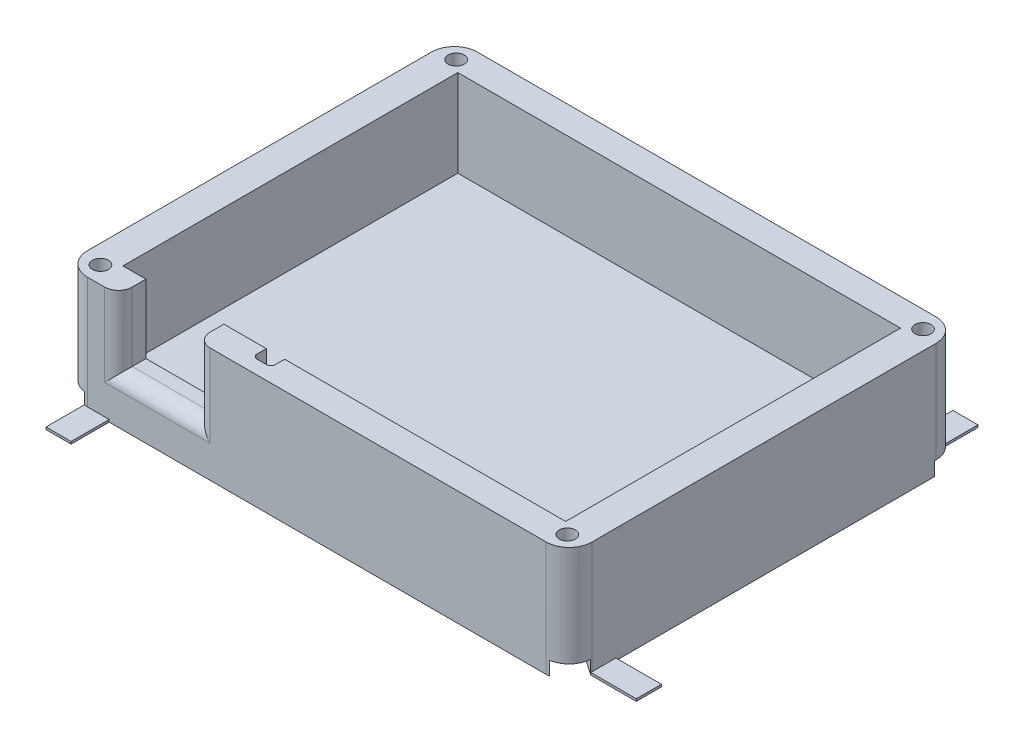
from build123d import *

# Parameters (mm, degrees)
SKETCH1_W                 = 110
SKETCH1_H                 = 85
BASE_DEPTH                = 25
FILLET1_R                 = 5
SKETCH2_W                 = 96.5
SKETCH2_H                 = 73
BASKET_DEPTH              = 19
SKETCH3_W                 = 4
SKETCH3_H                 = 6
WIRE_CHANNEL_DEPTH        = 19
WIRE_CHANNEL_ROUNDING_R   = 1
SWITCH_CUT_OUT_REACH      = 106.283
SKETCH5_W                 = 17
SKETCH5_H                 = 15
SWITCH_CUT_OUT_ROUNDING_R = 3
SKETCH14_R                = 1.75
CORNER_HOLES_DEPTH        = 74.866433513
BOTTOM_NUT_CUT_OUT_DEPTH  = 3
SKETCH18_W                = 8.304257035
SKETCH18_H                = 5.473277891
PRINTING_TIE_DOWNS_DEPTH  = 0.5


with BuildPart() as part:
    # Sketch1 → Base (new body)
    with BuildSketch(Plane(origin=(0, 0, 0), x_dir=(1, 0, 0), z_dir=(0, 1, 0))):
        Rectangle(SKETCH1_W, SKETCH1_H)
    extrude(amount=BASE_DEPTH)

    # Fillet1
    fillet1_edges = [part.edges().sort_by_distance(p)[0] for p in [
        (55, 12.5, 42.5),
        (-55, 12.5, 42.5),
        (-55, 12.5, -42.5),
        (55, 12.5, -42.5),
    ]]
    fillet(fillet1_edges, radius=FILLET1_R)

    # Sketch2 → Basket (cut)
    with BuildSketch(Plane(origin=(0, 25, 0), x_dir=(1, 0, 0), z_dir=(0, 1, 0))):
        Rectangle(SKETCH2_W, SKETCH2_H)
    extrude(amount=-BASKET_DEPTH, mode=Mode.SUBTRACT)

    # Sketch3 → Wire Channel (cut)
    with BuildSketch(Plane(origin=(0, 25, 0), x_dir=(1, 0, 0), z_dir=(0, 1, 0))):
        with Locations((-15, -36.5)):
            Rectangle(SKETCH3_W, SKETCH3_H)
    extrude(amount=-WIRE_CHANNEL_DEPTH, mode=Mode.SUBTRACT)

    # Wire Channel Rounding
    wire_channel_rounding_edges = [part.edges().sort_by_distance(p)[0] for p in [
        (-17, 15.5, 39.5),
        (-13, 15.5, 39.5),
    ]]
    fillet(wire_channel_rounding_edges, radius=WIRE_CHANNEL_ROUNDING_R)

    # Sketch5 → Switch Cut-out (cut, up to next)
    with BuildSketch(Plane.XY.offset(42.5), mode=Mode.PRIVATE) as switch_cut_out_sk1:
        with Locations((-34.75, 17.5)):
            Rectangle(SKETCH5_W, SKETCH5_H)
    switch_cut_out_tool1 = extrude(switch_cut_out_sk1.sketch, amount=-SWITCH_CUT_OUT_REACH, mode=Mode.PRIVATE) & part.part
    add(switch_cut_out_tool1.solids().sort_by_distance((-34.75, 17.5, 42.5))[0], mode=Mode.SUBTRACT)

    # Switch Cut-out Rounding
    switch_cut_out_rounding_edges = [part.edges().sort_by_distance(p)[0] for p in [
        (-43.25, 17.5, 42.5),
        (-34.75, 10, 42.5),
        (-26.25, 17.5, 42.5),
    ]]
    fillet(switch_cut_out_rounding_edges, radius=SWITCH_CUT_OUT_ROUNDING_R)

    # Sketch14 → Corner Holes (cut, through all)
    with BuildSketch(Plane(origin=(0, 25, 0), x_dir=(1, 0, 0), z_dir=(0, 1, 0))):
        with Locations(Location((-50.892766953, 38.767766953, 0), (0, 0, 270))):
            Circle(SKETCH14_R)
        with Locations(Location((50.892766953, 38.767766953, 0), (0, 0, 270))):
            Circle(SKETCH14_R)
        with Locations(Location((50.892766953, -38.767766953, 0), (0, 0, 270))):
            Circle(SKETCH14_R)
        with Locations(Location((-50.892766953, -38.767766953, 0), (0, 0, 270))):
            Circle(SKETCH14_R)
    extrude(amount=-CORNER_HOLES_DEPTH, mode=Mode.SUBTRACT)

    # Sketch15 → Bottom Nut Cut-out (cut)
    with BuildSketch(Plane.XZ):
        Polygon((-50.64101323, 42.388469214), (-52.178282629, 43.416097239), (-55.727023172, 38.10739593), (-54.143831126, 37.15203238), (-51.13140477, 35.13829702), (-47.868872697, 36.746365575), (-47.630234881, 40.375835508), align=None)
        Polygon((50.595962101, 42.39294376), (52.091508492, 43.427758232), (55.676210978, 38.247033564), (54.180664587, 37.212219092), (51.189571805, 35.142590146), (47.901674171, 36.698138008), (47.604869319, 40.323314814), align=None)
        Polygon((54.167766953, -36.699113605), (55.742766953, -37.608440279), (52.313760602, -43.547653498), (50.738760602, -42.638326824), (47.463760602, -40.747504693), (47.463760602, -36.788029213), (50.892766953, -34.808291473), align=None)
        Polygon((-53.9527362, -36.801402743), (-55.569189191, -37.634817242), (-52.682156679, -43.23437466), (-51.065703688, -42.400960161), (-47.832797706, -40.734131163), (-47.65986097, -37.100937955), (-50.719830218, -35.134573745), align=None)
    extrude(amount=-BOTTOM_NUT_CUT_OUT_DEPTH, mode=Mode.SUBTRACT)

    # Sketch18 → Printing Tie-downs (add)
    with BuildSketch(Plane.XZ):
        Polygon((-50.728122477, 42.446699673), (-50.728122477, 50.804257035), (-45.254844585, 50.804257035), (-45.254844585, 42.5), align=None)
        Polygon((54.992489727, 37.773945836), (64.927443113, 37.773945836), (64.927443113, 32.300667944), (55, 32.300667944), align=None)
        Polygon((50.462105691, -42.478600037), (50.462105691, -51.181840402), (44.9888278, -51.181840402), (44.9888278, -42.5), align=None)
        with Locations((-59.152128518, -34.604714443)):
            Rectangle(SKETCH18_W, SKETCH18_H)
    extrude(amount=-PRINTING_TIE_DOWNS_DEPTH)


solid = part.part
